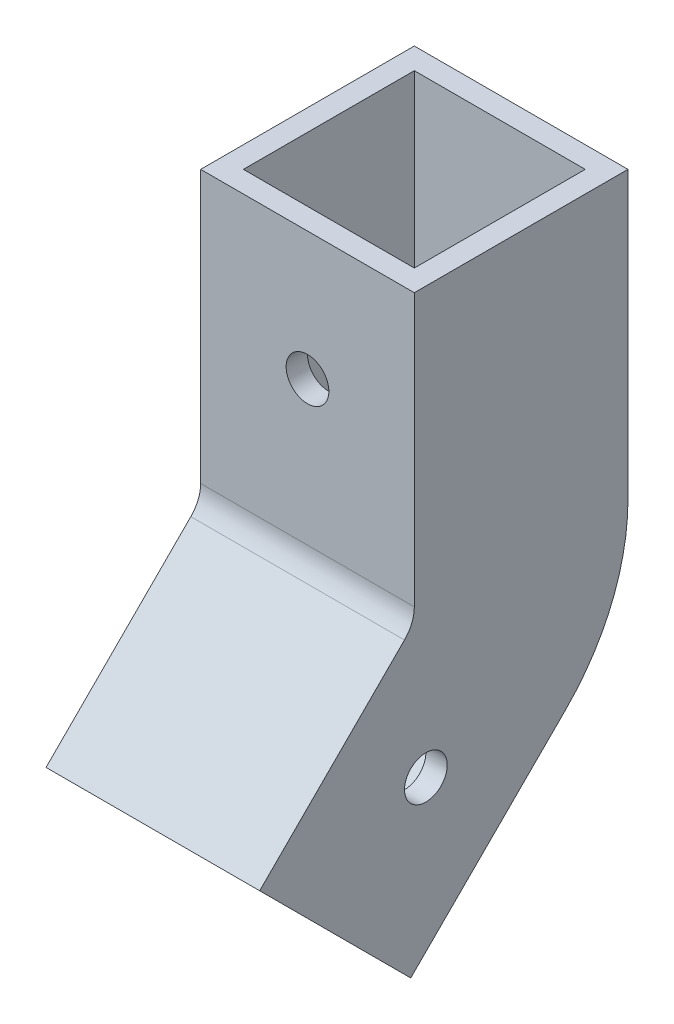
from build123d import *

# Parameters (mm, degrees)
BOSS_EXTRUDE1_DEPTH = 31.75
CUT_EXTRUDE2_START  = -3.175
CUT_EXTRUDE2_DEPTH  = 25.4
SKETCH4_W           = 25.4
SKETCH4_H           = 25.4
CUT_EXTRUDE3_DEPTH  = 3.175
SKETCH6_W           = 25.4
SKETCH6_H           = 25.4
CUT_EXTRUDE5_DEPTH  = 3.175
FILLET1_R           = 5
CUT_EXTRUDE6_REACH  = 79.895
SKETCH8_R           = 3.175
CUT_EXTRUDE7_REACH  = 69.69
SKETCH9_R           = 3.175


with BuildPart() as part:
    # Sketch1 → Boss-Extrude1 (new body)
    with BuildSketch(Plane(origin=(0, 0, 0), x_dir=(0, 0, -1), z_dir=(1, 0, 0))):
        with BuildLine():
            Line((15.875, 42.5), (-15.875, 42.5))
            Line((-15.875, 42.5), (-15.875, 0))
            Line((-15.875, 0), (-38.855970389, -22.980970389))
            Line((-38.855970389, -22.980970389), (-16.405330086, -45.431610691))
            Line((-16.405330086, -45.431610691), (6.575640303, -22.450640303))
            ThreePointArc((6.575640303, -22.450640303), (13.458175157, -12.150198978), (15.875, 0))
            Line((15.875, 0), (15.875, 42.5))
        make_face()
    extrude(amount=BOSS_EXTRUDE1_DEPTH)

    # Sketch3 → Cut-Extrude2 (cut)
    with BuildSketch(Plane.ZY.offset(CUT_EXTRUDE2_START)):
        with BuildLine():
            Line((16.405330086, -40.941482631), (34.365842328, -22.980970389))
            Line((34.365842328, -22.980970389), (12.7, -1.315128061))
            Line((12.7, -1.315128061), (12.7, 39.325))
            Line((12.7, 39.325), (-12.7, 39.325))
            Line((-12.7, 39.325), (-12.7, 0))
            ThreePointArc((-12.7, 0), (-10.524857642, -10.93517908), (-4.330576272, -20.205576272))
            Line((-4.330576272, -20.205576272), (16.405330086, -40.941482631))
        make_face()
    extrude(amount=-CUT_EXTRUDE2_DEPTH, mode=Mode.SUBTRACT)

    # Sketch4 → Cut-Extrude3 (cut)
    with BuildSketch(Plane(origin=(0, 42.5, 0), x_dir=(1, 0, 0), z_dir=(0, 1, 0))):
        with Locations((15.875, 0)):
            Rectangle(SKETCH4_W, SKETCH4_H)
    extrude(amount=-CUT_EXTRUDE3_DEPTH, mode=Mode.SUBTRACT)

    # Sketch6 → Cut-Extrude5 (cut)
    with BuildSketch(Plane(origin=(0, -30.918470389, 30.918470389), x_dir=(1, 0, 0), z_dir=(0, -0.7071067811865518, 0.7071067811865434))):
        with Locations((15.875, -4.649679849)):
            Rectangle(SKETCH6_W, SKETCH6_H)
    extrude(amount=-CUT_EXTRUDE5_DEPTH, mode=Mode.SUBTRACT)

    # Fillet1
    fillet1_edges = [part.edges().sort_by_distance(p)[0] for p in [
        (15.875, 0, 15.875),
        (15.875, -1.315128061, 12.7),
    ]]
    fillet(fillet1_edges, radius=FILLET1_R)

    # Cut-Extrude6: up to this face of the body (flat: up to its plane)
    cut_extrude6_end = Plane(part.part.faces().sort_by_distance((15.875, 22.285533906, 15.875))[0])
    # Sketch8 → Cut-Extrude6 (cut, up to the picked face)
    with BuildSketch(Plane(origin=(0, 0, -15.875), x_dir=(-1, 0, 0), z_dir=(0, 0, -1)), mode=Mode.PRIVATE) as cut_extrude6_sk1:
        with Locations((-15.875, 23.45)):
            Circle(SKETCH8_R)
    cut_extrude6_tool1 = split(extrude(cut_extrude6_sk1.sketch, amount=-CUT_EXTRUDE6_REACH, mode=Mode.PRIVATE), bisect_by=cut_extrude6_end, keep=Keep.BOTH, mode=Mode.PRIVATE)
    add(cut_extrude6_tool1.solids().sort_by(Axis((15.875, 23.45, -15.875), (0, 0, 1)))[0], mode=Mode.SUBTRACT)

    # Cut-Extrude7: up to this face of the body (flat: up to its plane)
    cut_extrude7_end = Plane(part.part.faces().sort_by_distance((0, 0.759502888, 5.54562078))[0])
    # Sketch9 → Cut-Extrude7 (cut, up to the picked face)
    with BuildSketch(Plane(origin=(31.75, 0, 0), x_dir=(0, 0, -1), z_dir=(1, 0, 0)), mode=Mode.PRIVATE) as cut_extrude7_sk1:
        with Locations(Location((-14.160266056, -20.735906358, 0), (0, 0, 180))):
            Circle(SKETCH9_R)
    cut_extrude7_tool1 = split(extrude(cut_extrude7_sk1.sketch, amount=-CUT_EXTRUDE7_REACH, mode=Mode.PRIVATE), bisect_by=cut_extrude7_end, keep=Keep.BOTH, mode=Mode.PRIVATE)
    add(cut_extrude7_tool1.solids().sort_by(Axis((31.75, -20.735906, 14.160266), (-1, 0, 0)))[0], mode=Mode.SUBTRACT)


solid = part.part
